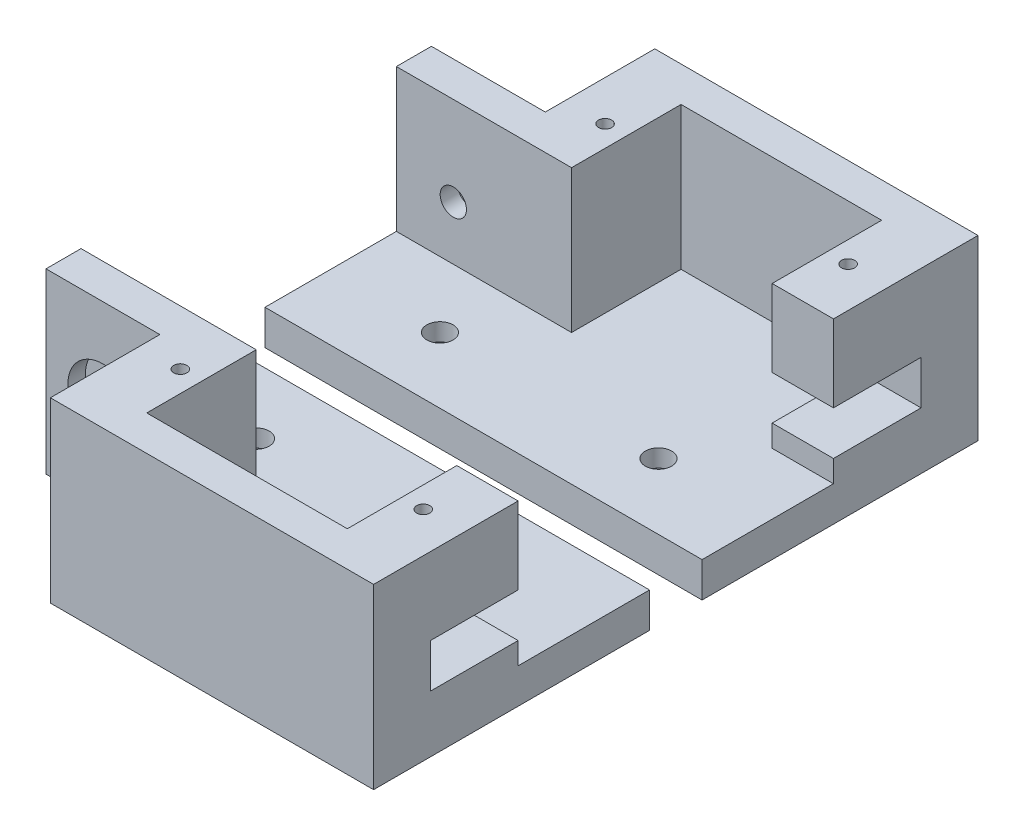
from build123d import *

# Parameters (mm, degrees)
EXTRUDE_THIN1_DEPTH = 16.3
BOSS_EXTRUDE1_DEPTH = 4
SKETCH3_W           = 3
SKETCH3_H           = 12.5
SKETCH3_H_2         = 16.5
BOSS_EXTRUDE2_DEPTH = 20.3
SKETCH4_W           = 3
SKETCH4_H           = 15
BOSS_EXTRUDE3_DEPTH = 4
SKETCH6_R           = 1.5
CUT_EXTRUDE1_DEPTH  = 38.841115206
SKETCH7_R           = 4
CUT_EXTRUDE2_DEPTH  = 2
SKETCH8_R           = 1.5
CUT_EXTRUDE3_DEPTH  = 39.996153656
SKETCH9_R           = 4
CUT_EXTRUDE4_DEPTH  = 2
SKETCH10_R          = 0.75
CUT_EXTRUDE5_DEPTH  = 10
SKETCH11_W          = 7
SKETCH11_H          = 5
CUT_EXTRUDE6_DEPTH  = 10


with BuildPart() as part:
    # Sketch1 → Extrude-Thin1 (new body)
    with BuildSketch(Plane(origin=(0, 0, 0), x_dir=(1, 0, 0), z_dir=(0, 1, 0))):
        Polygon((-20, 0), (0, 0), (0, 12.5), (22.9, 12.5), (22.9, 0), (26.9, 0), (26.9, 16.5), (-4, 16.5), (-4, 4), (-20, 4), align=None)
    extrude(amount=EXTRUDE_THIN1_DEPTH)

    # Sketch2 → Boss-Extrude1 (add)
    with BuildSketch(Plane.XZ):
        Polygon((-20, 0), (-20, 15), (26.9, 15), (26.9, 0), (26.9, -16.5), (-4, -16.5), (-4, -4), (-20, -4), align=None)
    extrude(amount=BOSS_EXTRUDE1_DEPTH)

    # Sketch3 → Boss-Extrude2 (add)
    with BuildSketch(Plane(origin=(0, 16.3, 0), x_dir=(1, 0, 0), z_dir=(0, 1, 0))):
        with Locations((-5.5, 10.25)):
            Rectangle(SKETCH3_W, SKETCH3_H)
        with Locations((28.4, 8.25)):
            Rectangle(SKETCH3_W, SKETCH3_H_2)
    extrude(amount=-BOSS_EXTRUDE2_DEPTH)

    # Sketch4 → Boss-Extrude3 (add)
    with BuildSketch(Plane.XZ.offset(4)):
        with Locations((28.4, 7.5)):
            Rectangle(SKETCH4_W, SKETCH4_H)
    extrude(amount=-BOSS_EXTRUDE3_DEPTH)

    # Sketch6 → Cut-Extrude1 (cut, through all)
    with BuildSketch(Plane(origin=(0, 0, 0), x_dir=(1, 0, 0), z_dir=(0, 1, 0))):
        with Locations(Location((-7.525, -7.5, 0), (0, 0, 270))):
            Circle(SKETCH6_R)
        with Locations(Location((17.425, -7.5, 0), (0, 0, 270))):
            Circle(SKETCH6_R)
    extrude(amount=-CUT_EXTRUDE1_DEPTH, mode=Mode.SUBTRACT)

    # Sketch7 → Cut-Extrude2 (cut)
    with BuildSketch(Plane.XZ.offset(4)):
        with Locations(Location((-7.525, 7.5, 0), (0, 0, 270))):
            Circle(SKETCH7_R)
        with Locations(Location((17.425, 7.5, 0), (0, 0, 270))):
            Circle(SKETCH7_R)
    extrude(amount=-CUT_EXTRUDE2_DEPTH, mode=Mode.SUBTRACT)

    # Sketch8 → Cut-Extrude3 (cut, through all)
    with BuildSketch(Plane(origin=(0, 0, -4), x_dir=(-1, 0, 0), z_dir=(0, 0, -1))):
        with Locations((13.5, 6.15)):
            Circle(SKETCH8_R)
    extrude(amount=-CUT_EXTRUDE3_DEPTH, mode=Mode.SUBTRACT)

    # Sketch9 → Cut-Extrude4 (cut)
    with BuildSketch(Plane(origin=(0, 0, -4), x_dir=(-1, 0, 0), z_dir=(0, 0, -1))):
        with Locations((13.5, 6.15)):
            Circle(SKETCH9_R)
    extrude(amount=-CUT_EXTRUDE4_DEPTH, mode=Mode.SUBTRACT)

    # Sketch10 → Cut-Extrude5 (cut)
    with BuildSketch(Plane(origin=(0, 16.3, 0), x_dir=(1, 0, 0), z_dir=(0, 1, 0))):
        with Locations(Location((-2.42, 6.25, 0), (0, 0, 270))):
            Circle(SKETCH10_R)
        with Locations(Location((25.32, 6.25, 0), (0, 0, 270))):
            Circle(SKETCH10_R)
    extrude(amount=-CUT_EXTRUDE5_DEPTH, mode=Mode.SUBTRACT)

    # Sketch11 → Cut-Extrude6 (cut)
    with BuildSketch(Plane.XY):
        with Locations((26.4, 5)):
            Rectangle(SKETCH11_W, SKETCH11_H)
    extrude(amount=-CUT_EXTRUDE6_DEPTH, mode=Mode.SUBTRACT)


with BuildPart() as body_2:
    # Mirror2: mirrored copy
    add(part.part.mirror(Plane.XY.offset(18)))


solid = Compound([part.part, body_2.part])
